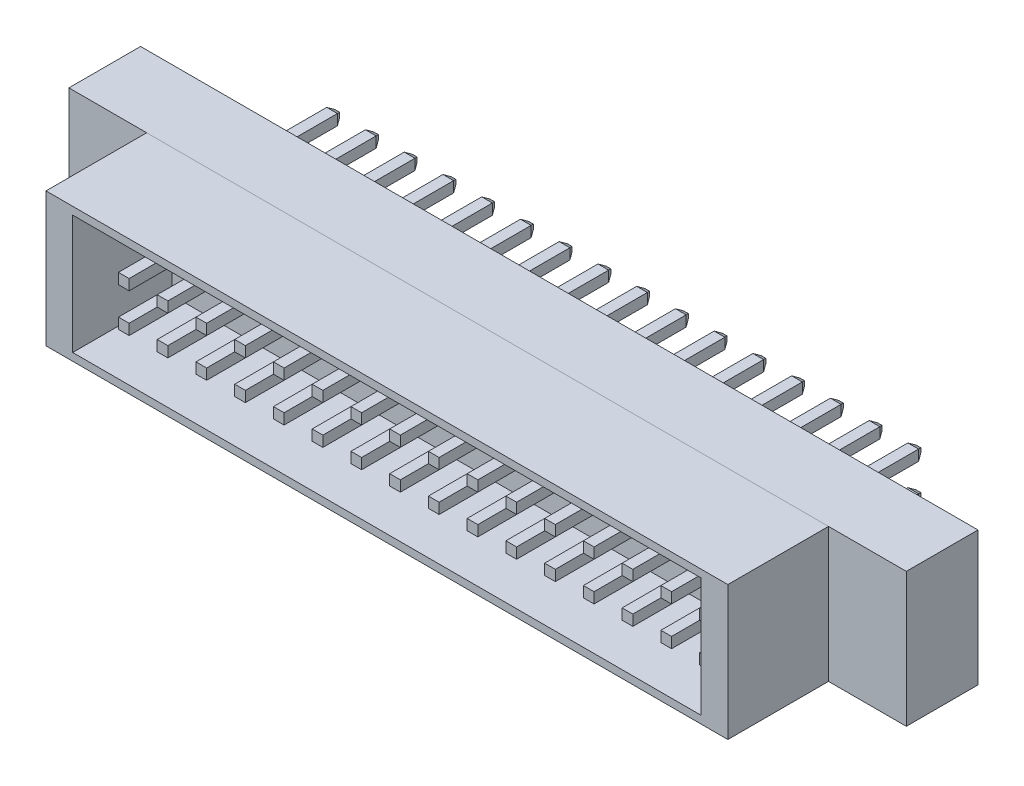
from build123d import *

# Parameters (mm, degrees)
EXTRUDE_1_DEPTH            = 9.5
EXTRUDE_1_DEPTH_BACK       = 4.5
SKETCH_1_W                 = 0.7
SKETCH_1_H                 = 0.7
CHAMFER_1_SIZE             = 0.2
CHAMFER_1_SIZE2            = 0.346410162
PATTERN_LINEAR_1_COUNT     = 3
PATTERN_LINEAR_1_PITCH     = 2.54
PATTERN_LINEAR_1_2_COUNT   = 16
PATTERN_LINEAR_1_2_PITCH   = 2.54
SKETCH_2_W                 = 54.9
SKETCH_2_H                 = 8.8
EXTRUDE_2_DEPTH            = 4.7
SKETCH_3_W                 = 44.7
SKETCH_3_H                 = 8.8
EXTRUDE_3_DEPTH            = 6.6
SHELL_1_T                  = -0.1
SHELL_1_THICKNESS_2_FACE_W = 6.5
SHELL_1_THICKNESS_2_FACE_H = 8.6
SHELL_1_THICKNESS_2_DEPTH  = 1.65
SHELL_1_THICKNESS_3_FACE_W = 6.5
SHELL_1_THICKNESS_3_FACE_H = 8.6
SHELL_1_THICKNESS_3_DEPTH  = 1.65
SHELL_1_THICKNESS_4_FACE_W = 6.5
SHELL_1_THICKNESS_4_FACE_H = 41.2
SHELL_1_THICKNESS_4_DEPTH  = 0.4
SHELL_1_THICKNESS_5_FACE_W = 6.5
SHELL_1_THICKNESS_5_FACE_H = 41.2
SHELL_1_THICKNESS_5_DEPTH  = 0.4


with BuildPart() as part:
    # Эскиз1 → Бобышка-Вытянуть1 (new, two sides: drawn at the far end of the back side and taken through both)
    with BuildSketch(Plane.XY.offset(-EXTRUDE_1_DEPTH_BACK)):
        with Locations((-19.05, 2.54)):
            Rectangle(SKETCH_1_W, SKETCH_1_H)
    extrude(amount=EXTRUDE_1_DEPTH + EXTRUDE_1_DEPTH_BACK)

    # Фаска1
    chamfer_1_edges = [part.edges().sort_by_distance(p)[0] for p in [
        (-19.4, 2.54, -4.5),
        (-19.05, 2.19, -4.5),
        (-18.7, 2.54, -4.5),
        (-19.05, 2.89, -4.5),
    ]]
    chamfer_1_side = [part.faces().sort_by_distance(p)[0] for p in [
        (-19.05, 2.54, -4.5),
    ]]
    chamfer(chamfer_1_edges, length=CHAMFER_1_SIZE, length2=CHAMFER_1_SIZE2, reference=chamfer_1_side[0])


with BuildPart() as pattern_linear_1_1:
    # Линейный массив1: pattern copy
    add(part.part.moved(Location(Vector(0, -1, 0) * (1 * PATTERN_LINEAR_1_PITCH))))


with BuildPart() as pattern_linear_1_2:
    # Линейный массив1: pattern copy
    add(part.part.moved(Location(Vector(0, -1, 0) * (2 * PATTERN_LINEAR_1_PITCH))))


with BuildPart() as pattern_linear_1_2_1:
    # Pattern Linear 1 2: pattern copy
    add(part.part.moved(Location(Vector(1, 0, 0) * (1 * PATTERN_LINEAR_1_2_PITCH))))


with BuildPart() as pattern_linear_1_2_2:
    # Pattern Linear 1 2: pattern copy
    add(part.part.moved(Location(Vector(1, 0, 0) * (2 * PATTERN_LINEAR_1_2_PITCH))))


with BuildPart() as pattern_linear_1_2_3:
    # Pattern Linear 1 2: pattern copy
    add(part.part.moved(Location(Vector(1, 0, 0) * (3 * PATTERN_LINEAR_1_2_PITCH))))


with BuildPart() as pattern_linear_1_2_4:
    # Pattern Linear 1 2: pattern copy
    add(part.part.moved(Location(Vector(1, 0, 0) * (4 * PATTERN_LINEAR_1_2_PITCH))))


with BuildPart() as pattern_linear_1_2_5:
    # Pattern Linear 1 2: pattern copy
    add(part.part.moved(Location(Vector(1, 0, 0) * (5 * PATTERN_LINEAR_1_2_PITCH))))


with BuildPart() as pattern_linear_1_2_6:
    # Pattern Linear 1 2: pattern copy
    add(part.part.moved(Location(Vector(1, 0, 0) * (6 * PATTERN_LINEAR_1_2_PITCH))))


with BuildPart() as pattern_linear_1_2_7:
    # Pattern Linear 1 2: pattern copy
    add(part.part.moved(Location(Vector(1, 0, 0) * (7 * PATTERN_LINEAR_1_2_PITCH))))


with BuildPart() as pattern_linear_1_2_8:
    # Pattern Linear 1 2: pattern copy
    add(part.part.moved(Location(Vector(1, 0, 0) * (8 * PATTERN_LINEAR_1_2_PITCH))))


with BuildPart() as pattern_linear_1_2_9:
    # Pattern Linear 1 2: pattern copy
    add(part.part.moved(Location(Vector(1, 0, 0) * (9 * PATTERN_LINEAR_1_2_PITCH))))


with BuildPart() as pattern_linear_1_2_10:
    # Pattern Linear 1 2: pattern copy
    add(part.part.moved(Location(Vector(1, 0, 0) * (10 * PATTERN_LINEAR_1_2_PITCH))))


with BuildPart() as pattern_linear_1_2_11:
    # Pattern Linear 1 2: pattern copy
    add(part.part.moved(Location(Vector(1, 0, 0) * (11 * PATTERN_LINEAR_1_2_PITCH))))


with BuildPart() as pattern_linear_1_2_12:
    # Pattern Linear 1 2: pattern copy
    add(part.part.moved(Location(Vector(1, 0, 0) * (12 * PATTERN_LINEAR_1_2_PITCH))))


with BuildPart() as pattern_linear_1_2_13:
    # Pattern Linear 1 2: pattern copy
    add(part.part.moved(Location(Vector(1, 0, 0) * (13 * PATTERN_LINEAR_1_2_PITCH))))


with BuildPart() as pattern_linear_1_2_14:
    # Pattern Linear 1 2: pattern copy
    add(part.part.moved(Location(Vector(1, 0, 0) * (14 * PATTERN_LINEAR_1_2_PITCH))))


with BuildPart() as pattern_linear_1_2_15:
    # Pattern Linear 1 2: pattern copy
    add(part.part.moved(Location(Vector(1, 0, 0) * (15 * PATTERN_LINEAR_1_2_PITCH))))


with BuildPart() as pattern_linear_1_2_16:
    # Pattern Linear 1 2: pattern copy
    add(pattern_linear_1_1.part.moved(Location(Vector(1, 0, 0) * (1 * PATTERN_LINEAR_1_2_PITCH))))


with BuildPart() as pattern_linear_1_2_17:
    # Pattern Linear 1 2: pattern copy
    add(pattern_linear_1_1.part.moved(Location(Vector(1, 0, 0) * (2 * PATTERN_LINEAR_1_2_PITCH))))


with BuildPart() as pattern_linear_1_2_18:
    # Pattern Linear 1 2: pattern copy
    add(pattern_linear_1_1.part.moved(Location(Vector(1, 0, 0) * (3 * PATTERN_LINEAR_1_2_PITCH))))


with BuildPart() as pattern_linear_1_2_19:
    # Pattern Linear 1 2: pattern copy
    add(pattern_linear_1_1.part.moved(Location(Vector(1, 0, 0) * (4 * PATTERN_LINEAR_1_2_PITCH))))


with BuildPart() as pattern_linear_1_2_20:
    # Pattern Linear 1 2: pattern copy
    add(pattern_linear_1_1.part.moved(Location(Vector(1, 0, 0) * (5 * PATTERN_LINEAR_1_2_PITCH))))


with BuildPart() as pattern_linear_1_2_21:
    # Pattern Linear 1 2: pattern copy
    add(pattern_linear_1_1.part.moved(Location(Vector(1, 0, 0) * (6 * PATTERN_LINEAR_1_2_PITCH))))


with BuildPart() as pattern_linear_1_2_22:
    # Pattern Linear 1 2: pattern copy
    add(pattern_linear_1_1.part.moved(Location(Vector(1, 0, 0) * (7 * PATTERN_LINEAR_1_2_PITCH))))


with BuildPart() as pattern_linear_1_2_23:
    # Pattern Linear 1 2: pattern copy
    add(pattern_linear_1_1.part.moved(Location(Vector(1, 0, 0) * (8 * PATTERN_LINEAR_1_2_PITCH))))


with BuildPart() as pattern_linear_1_2_24:
    # Pattern Linear 1 2: pattern copy
    add(pattern_linear_1_1.part.moved(Location(Vector(1, 0, 0) * (9 * PATTERN_LINEAR_1_2_PITCH))))


with BuildPart() as pattern_linear_1_2_25:
    # Pattern Linear 1 2: pattern copy
    add(pattern_linear_1_1.part.moved(Location(Vector(1, 0, 0) * (10 * PATTERN_LINEAR_1_2_PITCH))))


with BuildPart() as pattern_linear_1_2_26:
    # Pattern Linear 1 2: pattern copy
    add(pattern_linear_1_1.part.moved(Location(Vector(1, 0, 0) * (11 * PATTERN_LINEAR_1_2_PITCH))))


with BuildPart() as pattern_linear_1_2_27:
    # Pattern Linear 1 2: pattern copy
    add(pattern_linear_1_1.part.moved(Location(Vector(1, 0, 0) * (12 * PATTERN_LINEAR_1_2_PITCH))))


with BuildPart() as pattern_linear_1_2_28:
    # Pattern Linear 1 2: pattern copy
    add(pattern_linear_1_1.part.moved(Location(Vector(1, 0, 0) * (13 * PATTERN_LINEAR_1_2_PITCH))))


with BuildPart() as pattern_linear_1_2_29:
    # Pattern Linear 1 2: pattern copy
    add(pattern_linear_1_1.part.moved(Location(Vector(1, 0, 0) * (14 * PATTERN_LINEAR_1_2_PITCH))))


with BuildPart() as pattern_linear_1_2_30:
    # Pattern Linear 1 2: pattern copy
    add(pattern_linear_1_1.part.moved(Location(Vector(1, 0, 0) * (15 * PATTERN_LINEAR_1_2_PITCH))))


with BuildPart() as pattern_linear_1_2_31:
    # Pattern Linear 1 2: pattern copy
    add(pattern_linear_1_2.part.moved(Location(Vector(1, 0, 0) * (1 * PATTERN_LINEAR_1_2_PITCH))))


with BuildPart() as pattern_linear_1_2_32:
    # Pattern Linear 1 2: pattern copy
    add(pattern_linear_1_2.part.moved(Location(Vector(1, 0, 0) * (2 * PATTERN_LINEAR_1_2_PITCH))))


with BuildPart() as pattern_linear_1_2_33:
    # Pattern Linear 1 2: pattern copy
    add(pattern_linear_1_2.part.moved(Location(Vector(1, 0, 0) * (3 * PATTERN_LINEAR_1_2_PITCH))))


with BuildPart() as pattern_linear_1_2_34:
    # Pattern Linear 1 2: pattern copy
    add(pattern_linear_1_2.part.moved(Location(Vector(1, 0, 0) * (4 * PATTERN_LINEAR_1_2_PITCH))))


with BuildPart() as pattern_linear_1_2_35:
    # Pattern Linear 1 2: pattern copy
    add(pattern_linear_1_2.part.moved(Location(Vector(1, 0, 0) * (5 * PATTERN_LINEAR_1_2_PITCH))))


with BuildPart() as pattern_linear_1_2_36:
    # Pattern Linear 1 2: pattern copy
    add(pattern_linear_1_2.part.moved(Location(Vector(1, 0, 0) * (6 * PATTERN_LINEAR_1_2_PITCH))))


with BuildPart() as pattern_linear_1_2_37:
    # Pattern Linear 1 2: pattern copy
    add(pattern_linear_1_2.part.moved(Location(Vector(1, 0, 0) * (7 * PATTERN_LINEAR_1_2_PITCH))))


with BuildPart() as pattern_linear_1_2_38:
    # Pattern Linear 1 2: pattern copy
    add(pattern_linear_1_2.part.moved(Location(Vector(1, 0, 0) * (8 * PATTERN_LINEAR_1_2_PITCH))))


with BuildPart() as pattern_linear_1_2_39:
    # Pattern Linear 1 2: pattern copy
    add(pattern_linear_1_2.part.moved(Location(Vector(1, 0, 0) * (9 * PATTERN_LINEAR_1_2_PITCH))))


with BuildPart() as pattern_linear_1_2_40:
    # Pattern Linear 1 2: pattern copy
    add(pattern_linear_1_2.part.moved(Location(Vector(1, 0, 0) * (10 * PATTERN_LINEAR_1_2_PITCH))))


with BuildPart() as pattern_linear_1_2_41:
    # Pattern Linear 1 2: pattern copy
    add(pattern_linear_1_2.part.moved(Location(Vector(1, 0, 0) * (11 * PATTERN_LINEAR_1_2_PITCH))))


with BuildPart() as pattern_linear_1_2_42:
    # Pattern Linear 1 2: pattern copy
    add(pattern_linear_1_2.part.moved(Location(Vector(1, 0, 0) * (12 * PATTERN_LINEAR_1_2_PITCH))))


with BuildPart() as pattern_linear_1_2_43:
    # Pattern Linear 1 2: pattern copy
    add(pattern_linear_1_2.part.moved(Location(Vector(1, 0, 0) * (13 * PATTERN_LINEAR_1_2_PITCH))))


with BuildPart() as pattern_linear_1_2_44:
    # Pattern Linear 1 2: pattern copy
    add(pattern_linear_1_2.part.moved(Location(Vector(1, 0, 0) * (14 * PATTERN_LINEAR_1_2_PITCH))))


with BuildPart() as pattern_linear_1_2_45:
    # Pattern Linear 1 2: pattern copy
    add(pattern_linear_1_2.part.moved(Location(Vector(1, 0, 0) * (15 * PATTERN_LINEAR_1_2_PITCH))))


with BuildPart() as body_49:
    # Эскиз2 → Бобышка-Вытянуть2 (new body)
    with BuildSketch(Plane.XY):
        Rectangle(SKETCH_2_W, SKETCH_2_H)
    extrude(amount=EXTRUDE_2_DEPTH)


with BuildPart() as body_50:
    # Эскиз3 → Бобышка-Вытянуть3 (new body)
    with BuildSketch(Plane.XY.offset(4.7)):
        Rectangle(SKETCH_3_W, SKETCH_3_H)
    extrude(amount=EXTRUDE_3_DEPTH)

    # Оболочка1
    shell_1_openings = [body_50.faces().sort_by_distance(p)[0] for p in [
        (0, 0, 11.3),
    ]]
    offset(amount=SHELL_1_T, openings=shell_1_openings, kind=Kind.INTERSECTION)

    # Оболочка1 thickness 2 face (on inner face of the shell) → Оболочка1 thickness 2 (add)
    with BuildSketch(Plane(origin=(22.25, 0, 8.05), x_dir=(0, 0, 1), z_dir=(1, 0, 0))):
        Rectangle(SHELL_1_THICKNESS_2_FACE_W, SHELL_1_THICKNESS_2_FACE_H)
    extrude(amount=-SHELL_1_THICKNESS_2_DEPTH)

    # Оболочка1 thickness 3 face (on inner face of the shell) → Оболочка1 thickness 3 (add)
    with BuildSketch(Plane(origin=(-22.25, 0, 8.05), x_dir=(0, 0, -1), z_dir=(-1, 0, 0))):
        Rectangle(SHELL_1_THICKNESS_3_FACE_W, SHELL_1_THICKNESS_3_FACE_H)
    extrude(amount=-SHELL_1_THICKNESS_3_DEPTH)

    # Оболочка1 thickness 4 face (on inner face of the shell) → Оболочка1 thickness 4 (add)
    with BuildSketch(Plane(origin=(0, 4.3, 8.05), x_dir=(0, 0, 1), z_dir=(0, 1, 0))):
        Rectangle(SHELL_1_THICKNESS_4_FACE_W, SHELL_1_THICKNESS_4_FACE_H)
    extrude(amount=-SHELL_1_THICKNESS_4_DEPTH)

    # Оболочка1 thickness 5 face (on inner face of the shell) → Оболочка1 thickness 5 (add)
    with BuildSketch(Plane(origin=(0, -4.3, 8.05), x_dir=(0, 0, -1), z_dir=(0, -1, 0))):
        Rectangle(SHELL_1_THICKNESS_5_FACE_W, SHELL_1_THICKNESS_5_FACE_H)
    extrude(amount=-SHELL_1_THICKNESS_5_DEPTH)


solid = Compound([part.part, pattern_linear_1_1.part, pattern_linear_1_2.part, pattern_linear_1_2_1.part, pattern_linear_1_2_2.part, pattern_linear_1_2_3.part, pattern_linear_1_2_4.part, pattern_linear_1_2_5.part, pattern_linear_1_2_6.part, pattern_linear_1_2_7.part, pattern_linear_1_2_8.part, pattern_linear_1_2_9.part, pattern_linear_1_2_10.part, pattern_linear_1_2_11.part, pattern_linear_1_2_12.part, pattern_linear_1_2_13.part, pattern_linear_1_2_14.part, pattern_linear_1_2_15.part, pattern_linear_1_2_16.part, pattern_linear_1_2_17.part, pattern_linear_1_2_18.part, pattern_linear_1_2_19.part, pattern_linear_1_2_20.part, pattern_linear_1_2_21.part, pattern_linear_1_2_22.part, pattern_linear_1_2_23.part, pattern_linear_1_2_24.part, pattern_linear_1_2_25.part, pattern_linear_1_2_26.part, pattern_linear_1_2_27.part, pattern_linear_1_2_28.part, pattern_linear_1_2_29.part, pattern_linear_1_2_30.part, pattern_linear_1_2_31.part, pattern_linear_1_2_32.part, pattern_linear_1_2_33.part, pattern_linear_1_2_34.part, pattern_linear_1_2_35.part, pattern_linear_1_2_36.part, pattern_linear_1_2_37.part, pattern_linear_1_2_38.part, pattern_linear_1_2_39.part, pattern_linear_1_2_40.part, pattern_linear_1_2_41.part, pattern_linear_1_2_42.part, pattern_linear_1_2_43.part, pattern_linear_1_2_44.part, pattern_linear_1_2_45.part, body_49.part, body_50.part])
